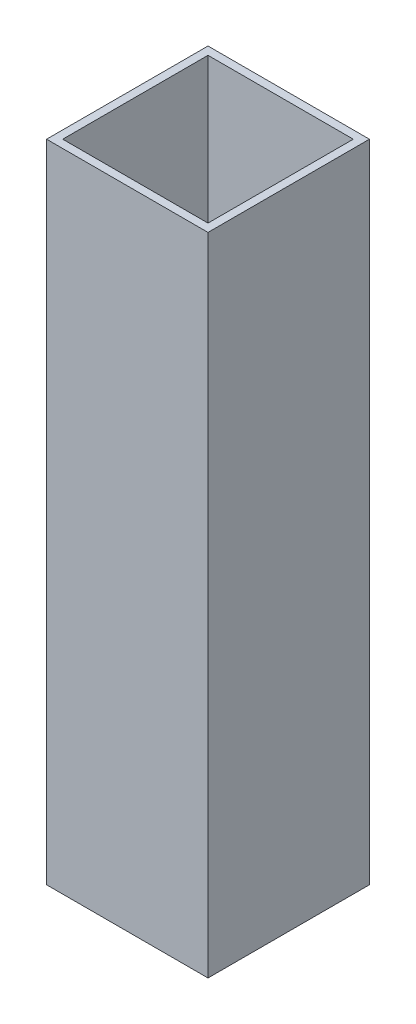
from build123d import *

# Parameters (mm, degrees)
SKETCH1_W           = 25
SKETCH1_H           = 25
SKETCH1_W_2         = 22.500853306
SKETCH1_H_2         = 22.500853306
BOSS_EXTRUDE1_DEPTH = 100


with BuildPart() as part:
    # Sketch1 → Boss-Extrude1 (new body)
    with BuildSketch(Plane(origin=(0, 0, 0), x_dir=(1, 0, 0), z_dir=(0, 1, 0))):
        Rectangle(SKETCH1_W, SKETCH1_H)
        Rectangle(SKETCH1_W_2, SKETCH1_H_2, mode=Mode.SUBTRACT)
    extrude(amount=BOSS_EXTRUDE1_DEPTH)


solid = part.part
